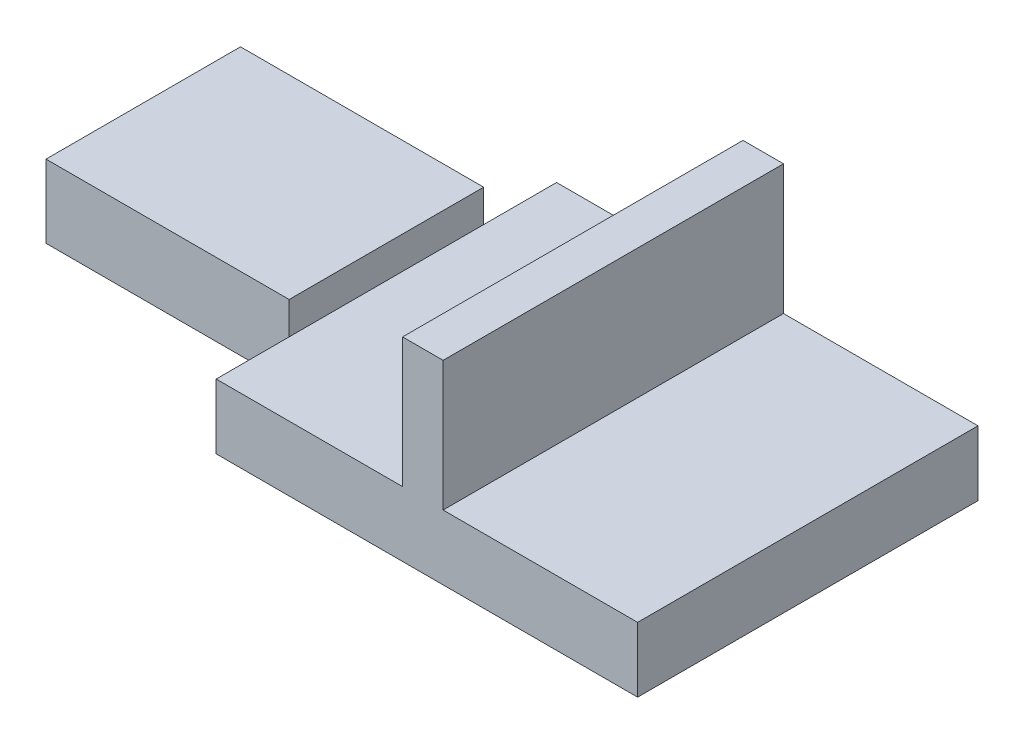
from build123d import *

# Parameters (mm, degrees)
BOSS_EXTRUDE2_DEPTH = 21
SKETCH2_W           = 12
SKETCH2_H           = 4.5
BOSS_EXTRUDE3_DEPTH = 15


with BuildPart() as part:
    # Sketch1 → Boss-Extrude2 (new body)
    with BuildSketch(Plane.XY):
        Polygon((1, 2), (1, 10), (-1.5, 10), (-1.5, 2), (-13, 2), (-13, -2), (13, -2), (13, 2), align=None)
    extrude(amount=BOSS_EXTRUDE2_DEPTH)

    # Sketch2 → Boss-Extrude3 (add)
    with BuildSketch(Plane.ZY.offset(13)):
        with Locations((10.5, 1.75)):
            Rectangle(SKETCH2_W, SKETCH2_H)
    extrude(amount=BOSS_EXTRUDE3_DEPTH)


solid = part.part
